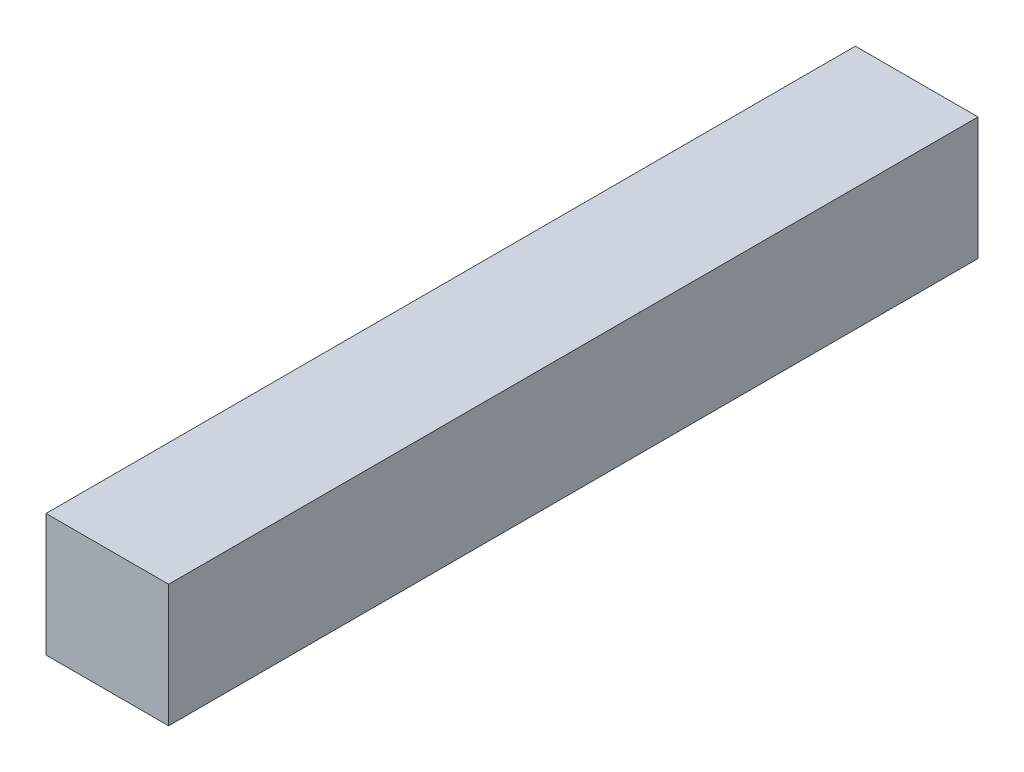
from build123d import *

# Parameters (mm, degrees)
SKETCH_1_W      = 10
SKETCH_1_H      = 10
EXTRUDE_1_DEPTH = 66


with BuildPart() as part:
    # Эскиз1 → Вытянуть1 (new body)
    with BuildSketch(Plane.XY):
        Rectangle(SKETCH_1_W, SKETCH_1_H)
    extrude(amount=EXTRUDE_1_DEPTH)


solid = part.part
